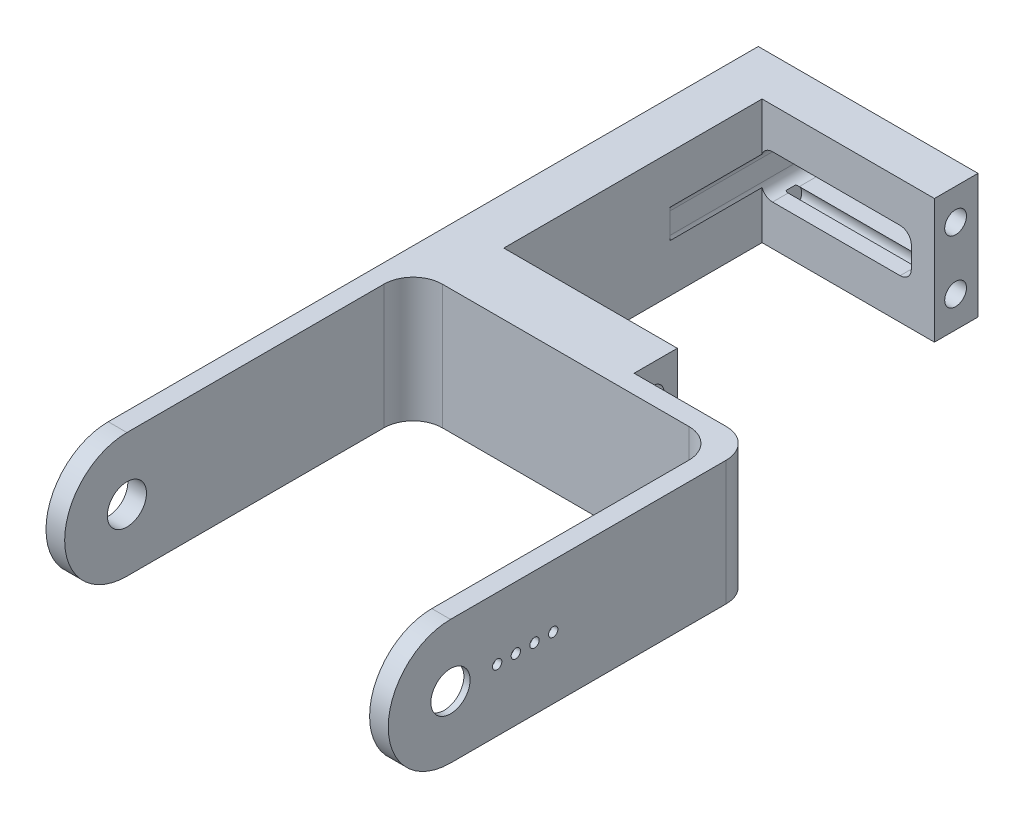
from build123d import *

# Parameters (mm, degrees)
AUFSATZ_LINEAR_AUSTRAGEN1_DEPTH      = 20
SCHNITT_LINEAR_AUSTRAGEN1_DEPTH      = 84.102346537
SKIZZE3_R                            = 3.15
SCHNITT_LINEAR_AUSTRAGEN2_DEPTH      = 84.102346537
SCHNITT_LINEAR_AUSTRAGEN3_DEPTH      = 2
SKIZZE5_R                            = 0.75
SCHNITT_LINEAR_AUSTRAGEN4_DEPTH      = 2
SKIZZE6_W                            = 35.5
SKIZZE6_H                            = 6.955295524
AUFSATZ_LINEAR_AUSTRAGEN2_DEPTH      = 20
SKIZZE7_W                            = 7.611739691
SKIZZE7_H                            = 53.192525908
AUFSATZ_LINEAR_AUSTRAGEN3_DEPTH      = 20
SKIZZE8_W                            = 7
SKIZZE8_H                            = 20
AUFSATZ_LINEAR_AUSTRAGEN4_DEPTH      = 27.7
SCHNITT_LINEAR_AUSTRAGEN5_DEPTH      = 26.48
SCHNITT_LINEAR_AUSTRAGEN6_DEPTH      = 6
SCHNITT_LINEAR_AUSTRAGEN6_DEPTH_BACK = 26.48
SKIZZE10_R                           = 1.75
SKIZZE11_R                           = 3
AUFSATZ_LINEAR_AUSTRAGEN5_DEPTH      = 4
SKIZZE12_W                           = 4.692525908
SKIZZE12_H                           = 20
SCHNITT_LINEAR_AUSTRAGEN7_DEPTH      = 130.77615571


with BuildPart() as part:
    # Skizze1 → Aufsatz-Linear austragen1 (new body)
    with BuildSketch(Plane(origin=(0, 0, 0), x_dir=(1, 0, 0), z_dir=(0, 1, 0))):
        with BuildLine():
            Line((0, 59), (0, 0))
            Line((0, 0), (3, 0))
            Line((3, 0), (3, 51.3))
            ThreePointArc((3, 51.3), (4.376598128, 54.623401872), (7.7, 56))
            Line((7.7, 56), (47.3, 56))
            ThreePointArc((47.3, 56), (50.623401872, 54.623401872), (52, 51.3))
            Line((52, 51.3), (52, 0))
            Line((52, 0), (55, 0))
            Line((55, 0), (55, 54.3))
            ThreePointArc((55, 54.3), (53.623401872, 57.623401872), (50.3, 59))
            Line((50.3, 59), (0, 59))
        make_face()
    extrude(amount=AUFSATZ_LINEAR_AUSTRAGEN1_DEPTH)

    # Skizze2 → Schnitt-Linear austragen1 (cut, through all)
    with BuildSketch(Plane(origin=(55, 0, 0), x_dir=(0, 0, -1), z_dir=(1, 0, 0))):
        with BuildLine():
            ThreePointArc((0, 10), (2.928932188, 17.071067812), (10, 20))
            Line((10, 20), (0, 20))
            Line((0, 20), (0, 10))
        make_face()
        with BuildLine():
            ThreePointArc((10, 0), (2.928932188, 2.928932188), (0, 10))
            Line((0, 10), (0, 0))
            Line((0, 0), (10, 0))
        make_face()
    extrude(amount=-SCHNITT_LINEAR_AUSTRAGEN1_DEPTH, mode=Mode.SUBTRACT)

    # Skizze3 → Schnitt-Linear austragen2 (cut, through all)
    with BuildSketch(Plane(origin=(55, 0, 0), x_dir=(0, 0, -1), z_dir=(1, 0, 0))):
        with Locations((10, 10)):
            Circle(SKIZZE3_R)
    extrude(amount=-SCHNITT_LINEAR_AUSTRAGEN2_DEPTH, mode=Mode.SUBTRACT)

    # Skizze4 → Schnitt-Linear austragen3 (cut)
    with BuildSketch(Plane.ZY.offset(-52)):
        with BuildLine():
            Line((-27.5, 7.5), (-12.823894492, 4.145461598))
            ThreePointArc((-12.823894492, 4.145461598), (-3.5, 10), (-12.823894492, 15.854538402))
            Line((-12.823894492, 15.854538402), (-27.5, 12.5))
            ThreePointArc((-27.5, 12.5), (-30, 10), (-27.5, 7.5))
        make_face()
    extrude(amount=-SCHNITT_LINEAR_AUSTRAGEN3_DEPTH, mode=Mode.SUBTRACT)

    # Skizze5 → Schnitt-Linear austragen4 (cut)
    with BuildSketch(Plane.ZY.offset(-54)):
        with Locations((-26.5, 10)):
            Circle(SKIZZE5_R)
        with Locations((-23.5, 10)):
            Circle(SKIZZE5_R)
        with Locations((-20.5, 10)):
            Circle(SKIZZE5_R)
        with Locations((-17.5, 10)):
            Circle(SKIZZE5_R)
    extrude(amount=-SCHNITT_LINEAR_AUSTRAGEN4_DEPTH, mode=Mode.SUBTRACT)

    # Skizze6 → Aufsatz-Linear austragen2 (add)
    with BuildSketch(Plane.XZ):
        with Locations((17.75, -62.477647762)):
            Rectangle(SKIZZE6_W, SKIZZE6_H)
    extrude(amount=-AUFSATZ_LINEAR_AUSTRAGEN2_DEPTH)

    # Skizze7 → Aufsatz-Linear austragen3 (add)
    with BuildSketch(Plane.XZ):
        with Locations((3.805869846, -92.551558478)):
            Rectangle(SKIZZE7_W, SKIZZE7_H)
    extrude(amount=-AUFSATZ_LINEAR_AUSTRAGEN3_DEPTH)

    # Skizze8 → Aufsatz-Linear austragen4 (add)
    with BuildSketch(Plane(origin=(7.611739691, 0, 0), x_dir=(0, 0, -1), z_dir=(1, 0, 0))):
        with Locations((110.955295524, 10)):
            Rectangle(SKIZZE8_W, SKIZZE8_H)
    extrude(amount=AUFSATZ_LINEAR_AUSTRAGEN4_DEPTH)

    # Skizze9 → Schnitt-Linear austragen5 (cut)
    with BuildSketch(Plane(origin=(0, 0, -119.147821432), x_dir=(-1, 0, 0), z_dir=(0, 0, -1))):
        with BuildLine():
            Line((-9.3, 13.5), (-29.794038703, 13.5))
            ThreePointArc((-29.794038703, 13.5), (-31.066830909, 12.972792206), (-31.594038703, 11.7))
            Line((-31.594038703, 11.7), (-31.594038703, 8.3))
            ThreePointArc((-31.594038703, 8.3), (-31.066830909, 7.027207794), (-29.794038703, 6.5))
            Line((-29.794038703, 6.5), (-9.3, 6.5))
            ThreePointArc((-9.3, 6.5), (-8.027207794, 7.027207794), (-7.5, 8.3))
            Line((-7.5, 8.3), (-7.5, 11.7))
            ThreePointArc((-7.5, 11.7), (-8.027207794, 12.972792206), (-9.3, 13.5))
        make_face()
    extrude(amount=-SCHNITT_LINEAR_AUSTRAGEN5_DEPTH, mode=Mode.SUBTRACT)

    # Skizze10 → Schnitt-Linear austragen6 (cut, two sides: drawn at the far end of the back side and taken through both)
    with BuildSketch(Plane(origin=(35.311739691, 0, 0), x_dir=(0, 0, -1), z_dir=(1, 0, 0)).offset(-SCHNITT_LINEAR_AUSTRAGEN6_DEPTH_BACK)):
        with Locations((62.055295524, 15)):
            Circle(SKIZZE10_R)
        with Locations((62.055295524, 5)):
            Circle(SKIZZE10_R)
        with Locations(Location((110.855295524, 5, 0), (0, 0, 180))):
            Circle(SKIZZE10_R)
        with Locations(Location((110.855295524, 15, 0), (0, 0, 180))):
            Circle(SKIZZE10_R)
    extrude(amount=SCHNITT_LINEAR_AUSTRAGEN6_DEPTH + SCHNITT_LINEAR_AUSTRAGEN6_DEPTH_BACK, mode=Mode.SUBTRACT)

    # Skizze11 → Aufsatz-Linear austragen5 (add)
    with BuildSketch(Plane.ZY):
        with Locations((-96.955295524, 10)):
            Circle(SKIZZE11_R)
    extrude(amount=AUFSATZ_LINEAR_AUSTRAGEN5_DEPTH)

    # Skizze12 → Schnitt-Linear austragen7 (cut, through all)
    with BuildSketch(Plane(origin=(7.611739691, 0, 0), x_dir=(0, 0, -1), z_dir=(1, 0, 0))):
        with Locations((116.801558478, 10)):
            Rectangle(SKIZZE12_W, SKIZZE12_H)
    extrude(amount=-SCHNITT_LINEAR_AUSTRAGEN7_DEPTH, mode=Mode.SUBTRACT)


solid = part.part
